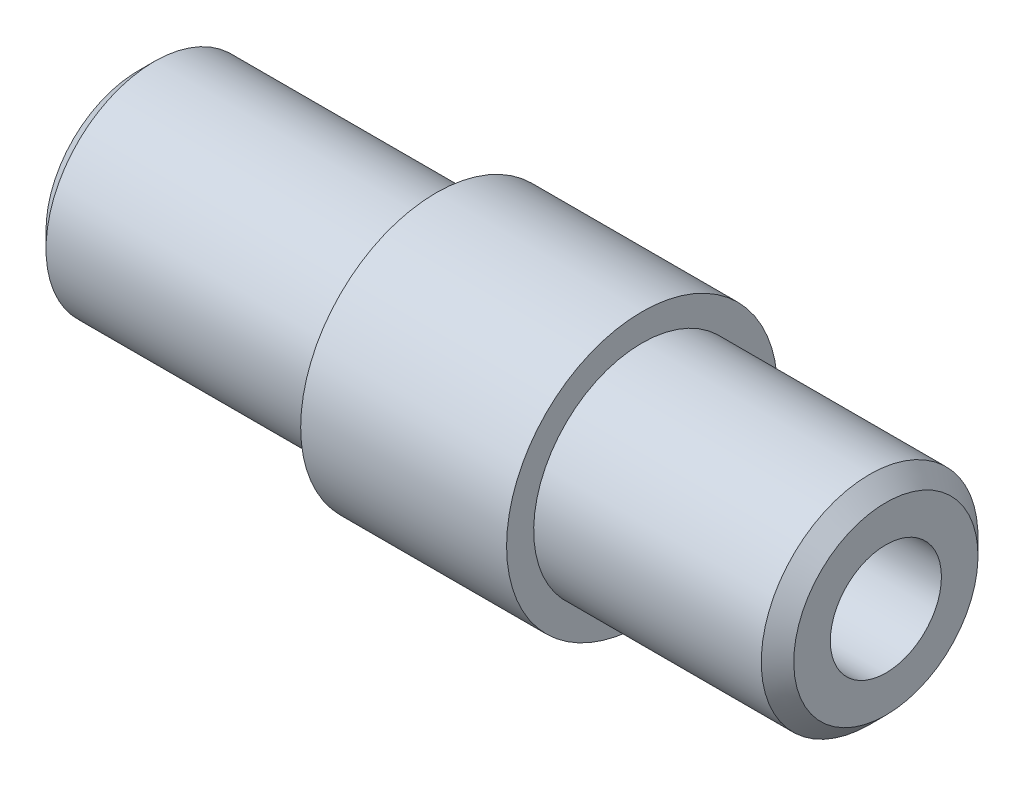
from build123d import *

# Parameters (mm, degrees)
TROU_TARAUD_M2_52_D     = 2.05
TROU_TARAUD_M2_52_DEPTH = 7.35
TROU_TARAUD_M2_52_TIP   = 0.615882135
TROU_TARAUD_M2_51_D     = 2.05
CHANFREIN1_SIZE         = 0.3


with BuildPart() as part:
    # Esquisse1 → Révolution1 (revolve)
    with BuildSketch(Plane.XY):
        Polygon((0, 0), (0, 2), (5.5, 2), (5.5, 2.5), (9.3, 2.5), (9.3, 2), (13.8, 2), (13.8, 0), align=None)
    revolve(axis=Axis((13.8, 0, 0), (-1, 0, 0)))

    # Trou taraudé M2.52
    with Locations(Plane.ZY):
        with Locations((0, 0)):
            Hole(TROU_TARAUD_M2_52_D / 2, depth=TROU_TARAUD_M2_52_DEPTH)
            with Locations((0, 0, -(TROU_TARAUD_M2_52_DEPTH + TROU_TARAUD_M2_52_TIP / 2))):  # 118° drill point
                Cone(0, TROU_TARAUD_M2_52_D / 2, TROU_TARAUD_M2_52_TIP, mode=Mode.SUBTRACT)

    # Trou taraudé M2.51 (through all)
    with Locations(Plane(origin=(13.8, 0, 0), x_dir=(0, 0, -1), z_dir=(1, 0, 0))):
        with Locations((0, 0)):
            Hole(TROU_TARAUD_M2_51_D / 2)

    # Chanfrein1
    chanfrein1_edges = [part.edges().sort_by_distance(p)[0] for p in [
        (0, -2, 0),
        (13.8, -2, 0),
    ]]
    chamfer(chanfrein1_edges, length=CHANFREIN1_SIZE)


solid = part.part
